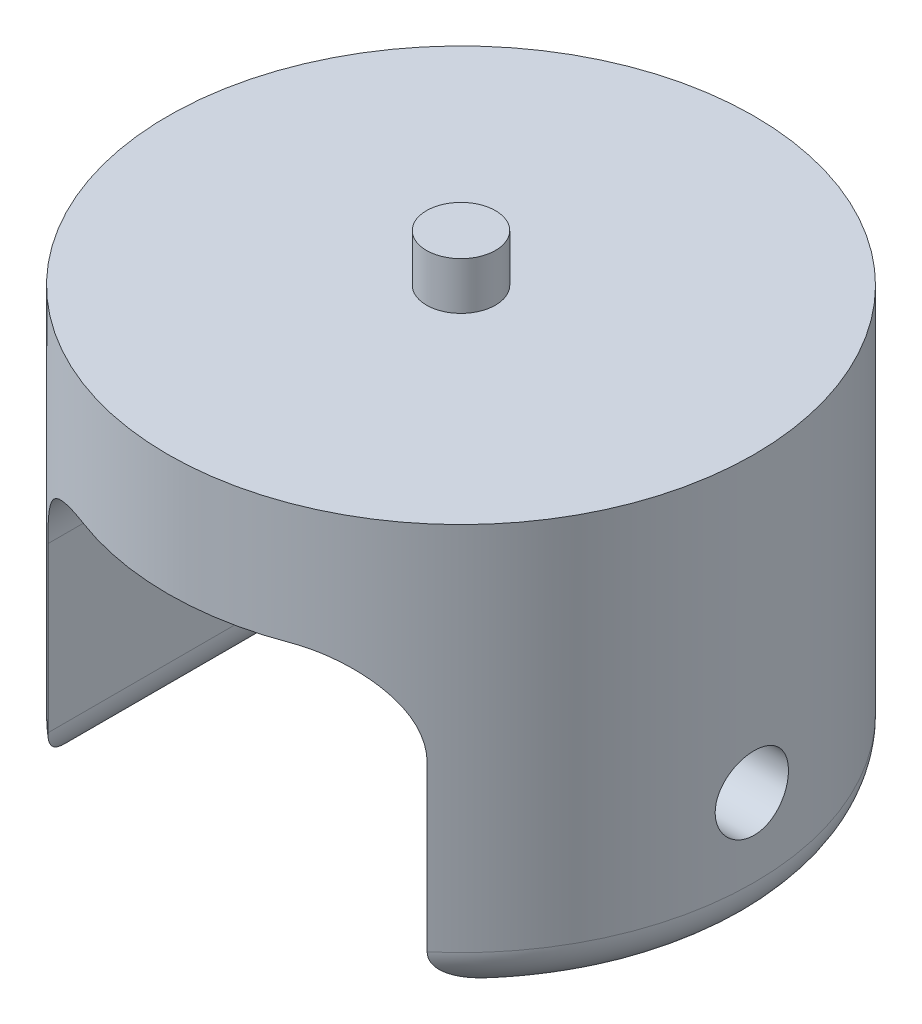
from build123d import *

# Parameters (mm, degrees)
SKETCH1_R               = 34
BOSS_EXTRUDE1_DEPTH     = 48
CUT_EXTRUDE1_DEPTH      = 68.941151006
CUT_EXTRUDE1_DEPTH_BACK = 68.941151006
FILLET6_R               = 5
CUT_EXTRUDE2_DEPTH      = 82.215762187
CUT_EXTRUDE2_DEPTH_BACK = 82.215762187
SKETCH5_R               = 4.25
SKETCH6_R               = 9.55
CUT_EXTRUDE3_DEPTH      = 6.2
SKETCH7_R               = 4
BOSS_EXTRUDE2_DEPTH     = 5.5


with BuildPart() as part:
    # Sketch1 → Boss-Extrude1 (new body)
    with BuildSketch(Plane(origin=(0, 0, 0), x_dir=(1, 0, 0), z_dir=(0, 1, 0))):
        with Locations(Location((0, 0, 0), (0, 0, 270))):
            Circle(SKETCH1_R)
    extrude(amount=BOSS_EXTRUDE1_DEPTH)

    # Sketch3 → Cut-Extrude1 (cut, two sides: drawn at the far end of the back side and taken through both)
    with BuildSketch(Plane.XY.offset(-CUT_EXTRUDE1_DEPTH_BACK)):
        with BuildLine():
            Line((-22, -157.512711317), (-22, 0))
            Line((-22, 0), (-22, 24))
            ThreePointArc((-22, 24), (-19.071067812, 31.071067812), (-12, 34))
            Line((-12, 34), (12, 34))
            ThreePointArc((12, 34), (19.071067812, 31.071067812), (22, 24))
            Line((22, 24), (22, 0))
            Line((22, 0), (22, -157.512711317))
            Line((22, -157.512711317), (22, -472.53813395))
            Line((22, -472.53813395), (-22, -472.53813395))
            Line((-22, -472.53813395), (-22, -157.512711317))
        make_face()
    extrude(amount=CUT_EXTRUDE1_DEPTH + CUT_EXTRUDE1_DEPTH_BACK, mode=Mode.SUBTRACT)

    # Fillet6
    fillet6_edges = [part.edges().sort_by_distance(p)[0] for p in [
        (34, 0, 0),
        (-34, 0, 0),
        (-22, 0, 0),
        (22, 0, 0),
    ]]
    fillet(fillet6_edges, radius=FILLET6_R)

    # Sketch5 → Cut-Extrude2 (cut, two sides: drawn at the far end of the back side and taken through both)
    with BuildSketch(Plane(origin=(-22, 0, 0), x_dir=(0, 0, -1), z_dir=(1, 0, 0)).offset(-CUT_EXTRUDE2_DEPTH_BACK)):
        with Locations(Location((0, 14, 0), (0, 0, 90))):
            Circle(SKETCH5_R)
    extrude(amount=CUT_EXTRUDE2_DEPTH + CUT_EXTRUDE2_DEPTH_BACK, mode=Mode.SUBTRACT)

    # Sketch6 → Cut-Extrude3 (cut)
    with BuildSketch(Plane(origin=(-22, 0, 0), x_dir=(0, 0, -1), z_dir=(1, 0, 0))):
        with Locations(Location((0, 14, 0), (0, 0, 90))):
            Circle(SKETCH6_R)
    extrude(amount=-CUT_EXTRUDE3_DEPTH, mode=Mode.SUBTRACT)

    # Sketch7 → Boss-Extrude2 (add)
    with BuildSketch(Plane(origin=(0, 48, 0), x_dir=(1, 0, 0), z_dir=(0, 1, 0))):
        with Locations(Location((0, 0, 0), (0, 0, 270))):
            Circle(SKETCH7_R)
    extrude(amount=BOSS_EXTRUDE2_DEPTH)


solid = part.part
